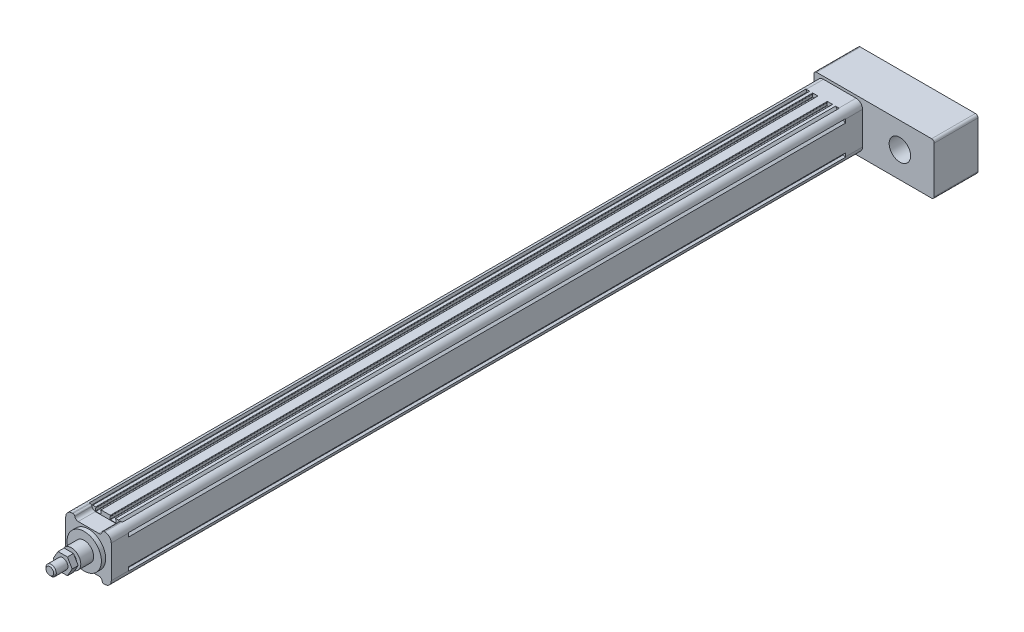
from build123d import *

# Parameters (mm, degrees)
SKETCH_1_R                  = 2.1
EXTRUDE_1_DEPTH             = 835
EXTRUDE_2_DEPTH             = 20
SKETCH_7_R                  = 20
EXTRUDE_3_DEPTH             = 5
SKETCH_9_R                  = 11
EXTRUDE_4_DEPTH             = 15
SKETCH_10_R                 = 6
EXTRUDE_5_DEPTH             = 25
EXTRUDE_START               = 20
EXTRUDE_6_DEPTH             = 20
EXTRUDE_7_DEPTH             = 51
SKETCH_13_R                 = 12.5
CUT_EXTRUDE_2_DEPTH         = 30
PATTERN_LINEAR_1_COUNT      = 2
PATTERN_LINEAR_1_PITCH      = 38
PATTERN_LINEAR_1_COUNT_DIR2 = 2
PATTERN_LINEAR_1_PITCH_DIR2 = 38
HOLE_WIZARD_M6_2_D          = 5
HOLE_WIZARD_M6_2_DEPTH      = 15
HOLE_WIZARD_M6_2_TIP        = 1.502151548
HOLE_WIZARD_M6_3_D          = 5
HOLE_WIZARD_M6_3_DEPTH      = 15
HOLE_WIZARD_M6_3_TIP        = 1.502151548
HOLE_WIZARD_M6_4_D          = 5
HOLE_WIZARD_M6_4_DEPTH      = 15
HOLE_WIZARD_M6_4_TIP        = 1.502151548
CHAMFER_1_SIZE              = 1.5
EXTRUDE_START_2             = 3
EXTRUDE_8_DEPTH             = 7


with BuildPart() as part:
    # 草图1 → 凸台-拉伸1 (new body)
    with BuildSketch(Plane.XY):
        with BuildLine():
            Line((-18.2, 24), (-19.443439638, 26.486879276))
            ThreePointArc((-19.443439638, 26.486879276), (-24.303300859, 24.303300859), (-26.486879276, 19.443439638))
            Line((-26.486879276, 19.443439638), (-24, 18.2))
            Line((-24, 18.2), (-24, 17.1))
            Line((-24, 17.1), (-26.5, 15))
            Line((-26.5, 15), (-26.5, -15))
            Line((-26.5, -15), (-24, -17.1))
            Line((-24, -17.1), (-24, -18.2))
            Line((-24, -18.2), (-26.486879276, -19.443439638))
            ThreePointArc((-26.486879276, -19.443439638), (-24.303300859, -24.303300859), (-19.443439638, -26.486879276))
            Line((-19.443439638, -26.486879276), (-18.2, -24))
            Line((-18.2, -24), (-17.1, -24))
            Line((-17.1, -24), (-15, -26.5))
            Line((-15, -26.5), (-11.65, -26.5))
            ThreePointArc((-11.65, -26.5), (-11.367157288, -26.382842712), (-11.25, -26.1))
            Line((-11.25, -26.1), (-11.25, -25.6))
            ThreePointArc((-11.25, -25.6), (-11.367157288, -25.317157288), (-11.65, -25.2))
            Line((-11.65, -25.2), (-11.75, -25.2))
            Line((-11.75, -25.2), (-11.75, -22.4))
            ThreePointArc((-11.75, -22.4), (-11.632842712, -22.117157288), (-11.35, -22))
            Line((-11.35, -22), (-5.65, -22))
            ThreePointArc((-5.65, -22), (-5.367157288, -22.117157288), (-5.25, -22.4))
            Line((-5.25, -22.4), (-5.25, -25.2))
            Line((-5.25, -25.2), (-5.35, -25.2))
            ThreePointArc((-5.35, -25.2), (-5.632842712, -25.317157288), (-5.75, -25.6))
            Line((-5.75, -25.6), (-5.75, -26.1))
            ThreePointArc((-5.75, -26.1), (-5.632842712, -26.382842712), (-5.35, -26.5))
            Line((-5.35, -26.5), (5.35, -26.5))
            ThreePointArc((5.35, -26.5), (5.632842712, -26.382842712), (5.75, -26.1))
            Line((5.75, -26.1), (5.75, -25.6))
            ThreePointArc((5.75, -25.6), (5.632842712, -25.317157288), (5.35, -25.2))
            Line((5.35, -25.2), (5.25, -25.2))
            Line((5.25, -25.2), (5.25, -22.4))
            ThreePointArc((5.25, -22.4), (5.367157288, -22.117157288), (5.65, -22))
            Line((5.65, -22), (11.35, -22))
            ThreePointArc((11.35, -22), (11.632842712, -22.117157288), (11.75, -22.4))
            Line((11.75, -22.4), (11.75, -25.2))
            Line((11.75, -25.2), (11.65, -25.2))
            ThreePointArc((11.65, -25.2), (11.367157288, -25.317157288), (11.25, -25.6))
            Line((11.25, -25.6), (11.25, -26.1))
            ThreePointArc((11.25, -26.1), (11.367157288, -26.382842712), (11.65, -26.5))
            Line((11.65, -26.5), (15, -26.5))
            Line((15, -26.5), (17.1, -24))
            Line((17.1, -24), (18.2, -24))
            Line((18.2, -24), (19.443439638, -26.486879276))
            ThreePointArc((19.443439638, -26.486879276), (24.303300859, -24.303300859), (26.486879276, -19.443439638))
            Line((26.486879276, -19.443439638), (24, -18.2))
            Line((24, -18.2), (24, -17.1))
            Line((24, -17.1), (26.5, -15))
            Line((26.5, -15), (26.5, 15))
            Line((26.5, 15), (24, 17.1))
            Line((24, 17.1), (24, 18.2))
            Line((24, 18.2), (26.486879276, 19.443439638))
            ThreePointArc((26.486879276, 19.443439638), (24.303300859, 24.303300859), (19.443439638, 26.486879276))
            Line((19.443439638, 26.486879276), (18.2, 24))
            Line((18.2, 24), (17.1, 24))
            Line((17.1, 24), (15, 26.5))
            Line((15, 26.5), (11.65, 26.5))
            ThreePointArc((11.65, 26.5), (11.367157288, 26.382842712), (11.25, 26.1))
            Line((11.25, 26.1), (11.25, 25.6))
            ThreePointArc((11.25, 25.6), (11.367157288, 25.317157288), (11.65, 25.2))
            Line((11.65, 25.2), (11.75, 25.2))
            Line((11.75, 25.2), (11.75, 22.4))
            ThreePointArc((11.75, 22.4), (11.632842712, 22.117157288), (11.35, 22))
            Line((11.35, 22), (5.65, 22))
            ThreePointArc((5.65, 22), (5.367157288, 22.117157288), (5.25, 22.4))
            Line((5.25, 22.4), (5.25, 25.2))
            Line((5.25, 25.2), (5.35, 25.2))
            ThreePointArc((5.35, 25.2), (5.632842712, 25.317157288), (5.75, 25.6))
            Line((5.75, 25.6), (5.75, 26.1))
            ThreePointArc((5.75, 26.1), (5.632842712, 26.382842712), (5.35, 26.5))
            Line((5.35, 26.5), (-5.35, 26.5))
            ThreePointArc((-5.35, 26.5), (-5.632842712, 26.382842712), (-5.75, 26.1))
            Line((-5.75, 26.1), (-5.75, 25.6))
            ThreePointArc((-5.75, 25.6), (-5.632842712, 25.317157288), (-5.35, 25.2))
            Line((-5.35, 25.2), (-5.25, 25.2))
            Line((-5.25, 25.2), (-5.25, 22.4))
            ThreePointArc((-5.25, 22.4), (-5.367157288, 22.117157288), (-5.65, 22))
            Line((-5.65, 22), (-11.35, 22))
            ThreePointArc((-11.35, 22), (-11.632842712, 22.117157288), (-11.75, 22.4))
            Line((-11.75, 22.4), (-11.75, 25.2))
            Line((-11.75, 25.2), (-11.65, 25.2))
            ThreePointArc((-11.65, 25.2), (-11.367157288, 25.317157288), (-11.25, 25.6))
            Line((-11.25, 25.6), (-11.25, 26.1))
            ThreePointArc((-11.25, 26.1), (-11.367157288, 26.382842712), (-11.65, 26.5))
            Line((-11.65, 26.5), (-15, 26.5))
            Line((-15, 26.5), (-17.1, 24))
            Line((-17.1, 24), (-18.2, 24))
        make_face()
        with Locations((19, 19)):
            Circle(SKETCH_1_R, mode=Mode.SUBTRACT)
        with Locations((19, -19)):
            Circle(SKETCH_1_R, mode=Mode.SUBTRACT)
        with Locations((-19, -19)):
            Circle(SKETCH_1_R, mode=Mode.SUBTRACT)
        with Locations((-19, 19)):
            Circle(SKETCH_1_R, mode=Mode.SUBTRACT)
        with BuildLine():
            Line((19.773719933, 3), (23.3, 3))
            Line((23.3, 3), (23.3, -3))
            Line((23.3, -3), (19.773719933, -3))
            ThreePointArc((19.773719933, -3), (0, -20), (-19.773719933, -3))
            Line((-19.773719933, -3), (-23.3, -3))
            Line((-23.3, -3), (-23.3, 3))
            Line((-23.3, 3), (-19.773719933, 3))
            ThreePointArc((-19.773719933, 3), (0, 20), (19.773719933, 3))
        make_face(mode=Mode.SUBTRACT)
    extrude(amount=EXTRUDE_1_DEPTH)

    # 草图6 → 凸台-拉伸2 (add)
    with BuildSketch(Plane.XY.offset(835)):
        with BuildLine():
            Line((-26.5, -19), (-26.5, 19))
            ThreePointArc((-26.5, 19), (-24.303300859, 24.303300859), (-19, 26.5))
            Line((-19, 26.5), (-17.916079783, 26.5))
            ThreePointArc((-17.916079783, 26.5), (-16.625085334, 26.027525232), (-15.944053189, 24.833333333))
            ThreePointArc((-15.944053189, 24.833333333), (-14.581988897, 22.444949537), (-12, 21.5))
            Line((-12, 21.5), (12, 21.5))
            ThreePointArc((12, 21.5), (14.581988897, 22.444949537), (15.944053189, 24.833333333))
            ThreePointArc((15.944053189, 24.833333333), (16.625085334, 26.027525232), (17.916079783, 26.5))
            Line((17.916079783, 26.5), (19, 26.5))
            ThreePointArc((19, 26.5), (24.303300859, 24.303300859), (26.5, 19))
            Line((26.5, 19), (26.5, -19))
            ThreePointArc((26.5, -19), (24.303300859, -24.303300859), (19, -26.5))
            Line((19, -26.5), (17.916079783, -26.5))
            ThreePointArc((17.916079783, -26.5), (16.625085334, -26.027525232), (15.944053189, -24.833333333))
            ThreePointArc((15.944053189, -24.833333333), (14.581988897, -22.444949537), (12, -21.5))
            Line((12, -21.5), (-12, -21.5))
            ThreePointArc((-12, -21.5), (-14.581988897, -22.444949537), (-15.944053189, -24.833333333))
            ThreePointArc((-15.944053189, -24.833333333), (-16.625085334, -26.027525232), (-17.916079783, -26.5))
            Line((-17.916079783, -26.5), (-19, -26.5))
            ThreePointArc((-19, -26.5), (-24.303300859, -24.303300859), (-26.5, -19))
        make_face()
    extrude(amount=EXTRUDE_2_DEPTH)

    # 草图7 → 凸台-拉伸3 (add)
    with BuildSketch(Plane.XY.offset(855)):
        Circle(SKETCH_7_R)
    extrude(amount=EXTRUDE_3_DEPTH)

    # 草图9 → 凸台-拉伸4 (add)
    with BuildSketch(Plane.XY.offset(860)):
        Circle(SKETCH_9_R)
    extrude(amount=EXTRUDE_4_DEPTH)

    # 草图10 → 凸台-拉伸5 (add)
    with BuildSketch(Plane.XY.offset(875)):
        Circle(SKETCH_10_R)
    extrude(amount=EXTRUDE_5_DEPTH)

    # 草图11 → 凸台-拉伸6 (add)
    with BuildSketch(Plane(origin=(0, 0, 0), x_dir=(-1, 0, 0), z_dir=(0, 0, -1)).offset(EXTRUDE_START)):
        with BuildLine():
            Line((-19, -26.5), (19, -26.5))
            ThreePointArc((19, -26.5), (24.303300859, -24.303300859), (26.5, -19))
            Line((26.5, -19), (26.5, 19))
            ThreePointArc((26.5, 19), (24.303300859, 24.303300859), (19, 26.5))
            Line((19, 26.5), (-19, 26.5))
            ThreePointArc((-19, 26.5), (-24.303300859, 24.303300859), (-26.5, 19))
            Line((-26.5, 19), (-26.5, -19))
            ThreePointArc((-26.5, -19), (-24.303300859, -24.303300859), (-19, -26.5))
        make_face()
    extrude(amount=-EXTRUDE_6_DEPTH)

    # 草图12 → 凸台-拉伸7 (add)
    with BuildSketch(Plane(origin=(0, 0, -20), x_dir=(-1, 0, 0), z_dir=(0, 0, -1))):
        with BuildLine():
            Line((-107, -30.404162038), (27, -30.404162038))
            ThreePointArc((27, -30.404162038), (29.121320344, -29.525482382), (30, -27.404162038))
            Line((30, -27.404162038), (30, 26.595837962))
            ThreePointArc((30, 26.595837962), (29.121320344, 28.717158305), (27, 29.595837962))
            Line((27, 29.595837962), (-107, 29.595837962))
            ThreePointArc((-107, 29.595837962), (-109.121320344, 28.717158305), (-110, 26.595837962))
            Line((-110, 26.595837962), (-110, -27.404162038))
            ThreePointArc((-110, -27.404162038), (-109.121320344, -29.525482382), (-107, -30.404162038))
        make_face()
    extrude(amount=EXTRUDE_7_DEPTH)

    # 草图13 → 切除-拉伸2 (cut)
    with BuildSketch(Plane.XY.offset(-20)):
        with Locations((70, 0)):
            Circle(SKETCH_13_R)
    extrude(amount=-CUT_EXTRUDE_2_DEPTH, mode=Mode.SUBTRACT)

    # 草图15 → M6 螺纹孔1 (revolve, cut)
    with BuildSketch(Plane(origin=(-19, -19, -71), x_dir=(0, 1, 0), z_dir=(1, 0, 0))):
        Polygon((0, 0), (0, 16.502151548), (2.5, 15), (2.5, 0), align=None)
    hole_wizard_m6_1 = revolve(axis=Axis((-19, -19, -77.35), (0, 0, 1)), mode=Mode.SUBTRACT)

    # 阵列(线性)1: Hole Wizard M6 _1 2 × 2
    with Locations(*[(j * PATTERN_LINEAR_1_PITCH_DIR2, i * PATTERN_LINEAR_1_PITCH, 0) for i in range(PATTERN_LINEAR_1_COUNT) for j in range(PATTERN_LINEAR_1_COUNT_DIR2) if (i, j) != (0, 0)]):
        add(hole_wizard_m6_1, mode=Mode.SUBTRACT)

    # M6 螺纹孔2
    with Locations(Plane(origin=(0, 0, -71), x_dir=(-1, 0, 0), z_dir=(0, 0, -1))):
        with Locations((-84, -19), (-84, 19)):
            Hole(HOLE_WIZARD_M6_2_D / 2, depth=HOLE_WIZARD_M6_2_DEPTH)
            with Locations((0, 0, -(HOLE_WIZARD_M6_2_DEPTH + HOLE_WIZARD_M6_2_TIP / 2))):  # 118° drill point
                Cone(0, HOLE_WIZARD_M6_2_D / 2, HOLE_WIZARD_M6_2_TIP, mode=Mode.SUBTRACT)

    # M6 螺纹孔3
    with Locations(Plane.ZY.offset(26.5)):
        with Locations((845, 11), (845, -11)):
            Hole(HOLE_WIZARD_M6_3_D / 2, depth=HOLE_WIZARD_M6_3_DEPTH)
            with Locations((0, 0, -(HOLE_WIZARD_M6_3_DEPTH + HOLE_WIZARD_M6_3_TIP / 2))):  # 118° drill point
                Cone(0, HOLE_WIZARD_M6_3_D / 2, HOLE_WIZARD_M6_3_TIP, mode=Mode.SUBTRACT)

    # M6 螺纹孔4
    with Locations(Plane.ZY.offset(26.5)):
        with Locations((-10, 11), (-10, -11)):
            Hole(HOLE_WIZARD_M6_4_D / 2, depth=HOLE_WIZARD_M6_4_DEPTH)
            with Locations((0, 0, -(HOLE_WIZARD_M6_4_DEPTH + HOLE_WIZARD_M6_4_TIP / 2))):  # 118° drill point
                Cone(0, HOLE_WIZARD_M6_4_D / 2, HOLE_WIZARD_M6_4_TIP, mode=Mode.SUBTRACT)

    # 倒角1
    chamfer_1_edges = [part.edges().sort_by_distance(p)[0] for p in [
        (-6, 0, 900),
    ]]
    chamfer(chamfer_1_edges, length=CHAMFER_1_SIZE)

    # 草图23 → 凸台-拉伸8 (add)
    with BuildSketch(Plane.XY.offset(875).offset(EXTRUDE_START_2)):
        Polygon((10.969655115, 0), (5.484827557, 9.5), (-5.484827557, 9.5), (-10.969655115, 0), (-5.484827557, -9.5), (5.484827557, -9.5), align=None)
    extrude(amount=EXTRUDE_8_DEPTH)


solid = part.part
